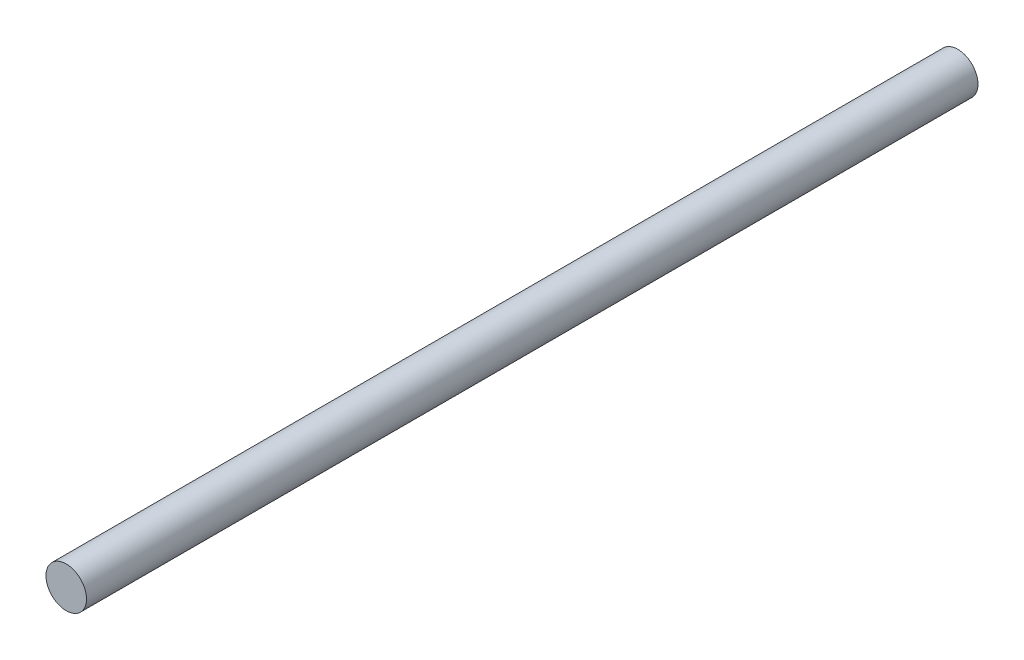
from build123d import *

# Parameters (mm, degrees)
SKETCH1_R           = 6.35
BOSS_EXTRUDE1_DEPTH = 279.4


with BuildPart() as part:
    # Sketch1 → Boss-Extrude1 (new body)
    with BuildSketch(Plane.XY):
        Circle(SKETCH1_R)
    extrude(amount=BOSS_EXTRUDE1_DEPTH)


solid = part.part
